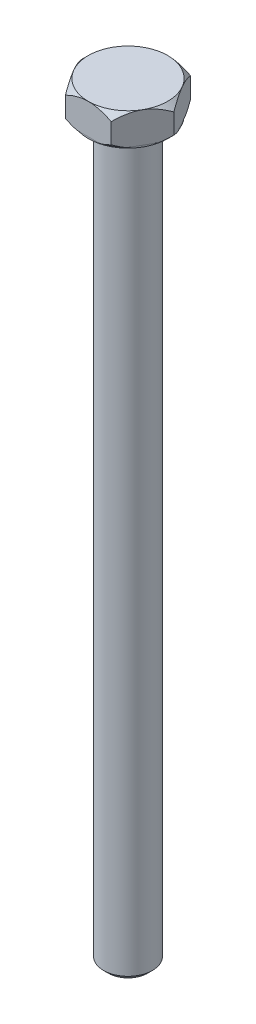
from build123d import *

# Parameters (mm, degrees)
BOSS_EXTRUDE1_DEPTH = 5.3
SKETCH2_OUTSIDE_W   = 21.122
SKETCH2_OUTSIDE_H   = 19.11
SKETCH2_OUTSIDE_R   = 6.5
CUT_EXTRUDE1_DEPTH  = 0.265
SKETCH3_R           = 4
BOSS_EXTRUDE2_DEPTH = 120
CHAMFER1_SIZE       = 0.8


with BuildPart() as part:
    # Sketch1 → Boss-Extrude1 (new body)
    with BuildSketch(Plane(origin=(0, 0, 0), x_dir=(1, 0, 0), z_dir=(0, 1, 0))):
        Polygon((7.505553499, 0), (3.75277675, 6.5), (-3.75277675, 6.5), (-7.505553499, 0), (-3.75277675, -6.5), (3.75277675, -6.5), align=None)
    extrude(amount=-BOSS_EXTRUDE1_DEPTH)

    # Sketch4 → Cut-Revolve1 (revolve, cut)
    with BuildSketch(Plane(origin=(0, 0, 0), x_dir=(0, 0, -1), z_dir=(1, 0, 0))):
        Polygon((-6.5, 0), (-8.15, 0), (-8.15, -1.65), align=None)
        Polygon((-8.15, -3.65), (-6.5, -5.3), (-8.15, -5.3), align=None)
    revolve(axis=Axis((0, 0, 0), (0, -1, 0)), mode=Mode.SUBTRACT)

    # Sketch2 outside → Cut-Extrude1 (cut)
    with BuildSketch(Plane.XZ.offset(5.3)):
        Rectangle(SKETCH2_OUTSIDE_W, SKETCH2_OUTSIDE_H)
        with Locations(Location((0, 0, 0), (0, 0, 90))):
            Circle(SKETCH2_OUTSIDE_R, mode=Mode.SUBTRACT)
    extrude(amount=-CUT_EXTRUDE1_DEPTH, mode=Mode.SUBTRACT)

    # Sketch3 → Boss-Extrude2 (add)
    with BuildSketch(Plane.XZ.offset(5.3)):
        with Locations(Location((0, 0, 0), (0, 0, 90))):
            Circle(SKETCH3_R)
    extrude(amount=BOSS_EXTRUDE2_DEPTH)

    # Chamfer1
    chamfer1_edges = [part.edges().sort_by_distance(p)[0] for p in [
        (0, -125.3, -4),
    ]]
    chamfer(chamfer1_edges, length=CHAMFER1_SIZE)


solid = part.part
